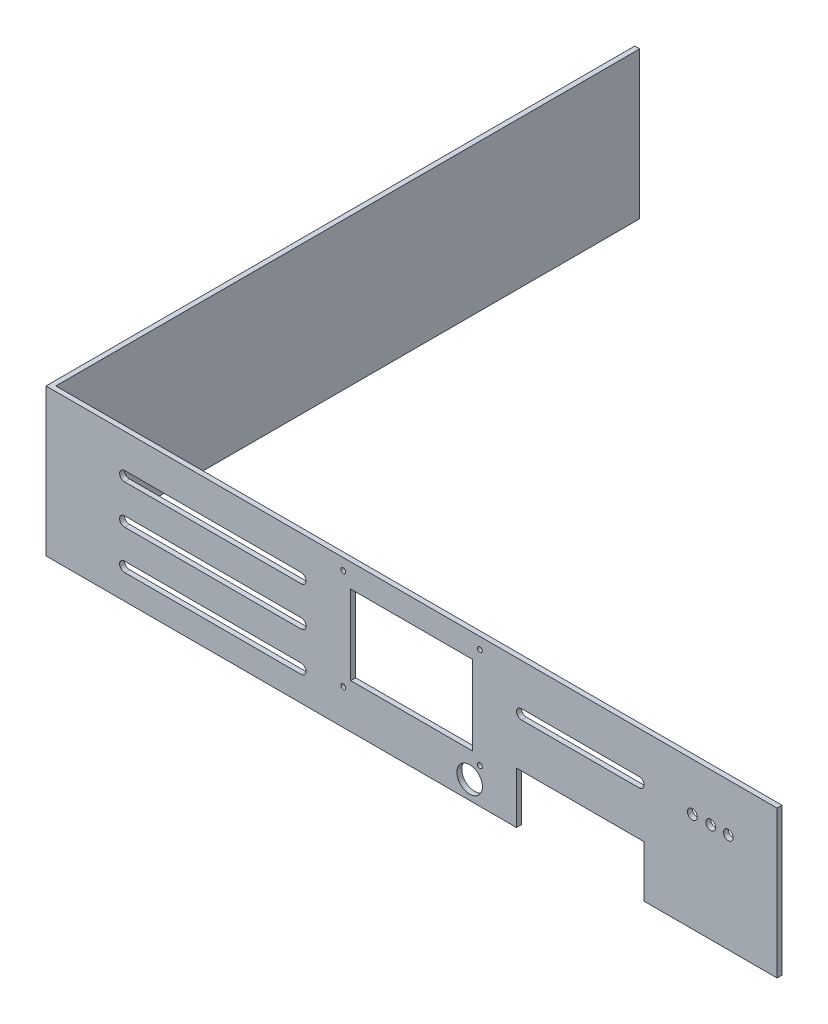
from build123d import *

# Parameters (mm, degrees)
SKETCH1_W           = 473.075
SKETCH1_H           = 95.25
BOSS_EXTRUDE1_DEPTH = 3.175
SKETCH3_W           = 78.74
SKETCH3_H           = 51.308
CUT_EXTRUDE2_DEPTH  = 242.305221983
SKETCH4_R           = 8.255
CUT_EXTRUDE3_DEPTH  = 242.305221983
SKETCH5_R           = 1.5875
CUT_EXTRUDE4_DEPTH  = 242.305221983
SKETCH6_W           = 3.175
SKETCH6_H           = 95.25
BOSS_EXTRUDE2_DEPTH = 377.825
SKETCH8_W           = 82.55
SKETCH8_H           = 33.324907577
CUT_EXTRUDE6_DEPTH  = 29.464
SKETCH9_R           = 3.175
CUT_EXTRUDE7_DEPTH  = 451.975752709


with BuildPart() as part:
    # Sketch1 → Boss-Extrude1 (new body)
    with BuildSketch(Plane.XY):
        Rectangle(SKETCH1_W, SKETCH1_H)
    extrude(amount=BOSS_EXTRUDE1_DEPTH)

    # Sketch3 → Cut-Extrude2 (cut, through all)
    with BuildSketch(Plane.XY.offset(3.175)):
        with Locations((0, 6.731)):
            Rectangle(SKETCH3_W, SKETCH3_H)
    extrude(amount=-CUT_EXTRUDE2_DEPTH, mode=Mode.SUBTRACT)

    # Sketch4 → Cut-Extrude3 (cut, through all)
    with BuildSketch(Plane.XY.offset(3.175)):
        with Locations((37.592, -35.814)):
            Circle(SKETCH4_R)
    extrude(amount=-CUT_EXTRUDE3_DEPTH, mode=Mode.SUBTRACT)

    # Sketch5 → Cut-Extrude4 (cut, through all)
    with BuildSketch(Plane.XY.offset(3.175)):
        with Locations((-44.196, 40.259)):
            Circle(SKETCH5_R)
        with Locations((44.196, 40.259)):
            Circle(SKETCH5_R)
        with Locations((-44.196, -24.765)):
            Circle(SKETCH5_R)
        with Locations((44.196, -24.765)):
            Circle(SKETCH5_R)
    extrude(amount=-CUT_EXTRUDE4_DEPTH, mode=Mode.SUBTRACT)

    # Sketch6 → Boss-Extrude2 (add)
    with BuildSketch(Plane(origin=(0, 0, 0), x_dir=(-1, 0, 0), z_dir=(0, 0, -1))):
        with Locations((234.95, 0)):
            Rectangle(SKETCH6_W, SKETCH6_H)
    extrude(amount=BOSS_EXTRUDE2_DEPTH)

    # Sketch8 → Cut-Extrude6 (cut)
    with BuildSketch(Plane.XY.offset(3.175)):
        with Locations((109.22, -30.962546212)):
            Rectangle(SKETCH8_W, SKETCH8_H)
        with BuildLine():
            Line((71.12, 14.274907577), (147.32, 14.274907577))
            ThreePointArc((147.32, 14.274907577), (150.495, 17.449907577), (147.32, 20.624907577))
            Line((147.32, 20.624907577), (71.12, 20.624907577))
            ThreePointArc((71.12, 20.624907577), (67.945, 17.449907577), (71.12, 14.274907577))
        make_face()
        with BuildLine():
            Line((-185.7375, 19.318625561), (-71.4375, 19.318625561))
            ThreePointArc((-71.4375, 19.318625561), (-68.2625, 22.493625561), (-71.4375, 25.668625561))
            Line((-71.4375, 25.668625561), (-185.7375, 25.668625561))
            ThreePointArc((-185.7375, 25.668625561), (-188.9125, 22.493625561), (-185.7375, 19.318625561))
        make_face()
        with BuildLine():
            Line((-185.7375, -6.081374439), (-71.4375, -6.081374439))
            ThreePointArc((-71.4375, -6.081374439), (-68.2625, -2.906374439), (-71.4375, 0.268625561))
            Line((-71.4375, 0.268625561), (-185.7375, 0.268625561))
            ThreePointArc((-185.7375, 0.268625561), (-188.9125, -2.906374439), (-185.7375, -6.081374439))
        make_face()
        with BuildLine():
            Line((-185.7375, -31.481374439), (-71.4375, -31.481374439))
            ThreePointArc((-71.4375, -31.481374439), (-68.2625, -28.306374439), (-71.4375, -25.131374439))
            Line((-71.4375, -25.131374439), (-185.7375, -25.131374439))
            ThreePointArc((-185.7375, -25.131374439), (-188.9125, -28.306374439), (-185.7375, -31.481374439))
        make_face()
    extrude(amount=-CUT_EXTRUDE6_DEPTH, mode=Mode.SUBTRACT)

    # Sketch9 → Cut-Extrude7 (cut, through all)
    with BuildSketch(Plane.XY.offset(3.175)):
        with Locations((181.715661459, 16.725735437)):
            Circle(SKETCH9_R)
        with Locations((193.599351225, 16.725735437)):
            Circle(SKETCH9_R)
        with Locations((204.910333051, 16.725735437)):
            Circle(SKETCH9_R)
    extrude(amount=-CUT_EXTRUDE7_DEPTH, mode=Mode.SUBTRACT)


solid = part.part
